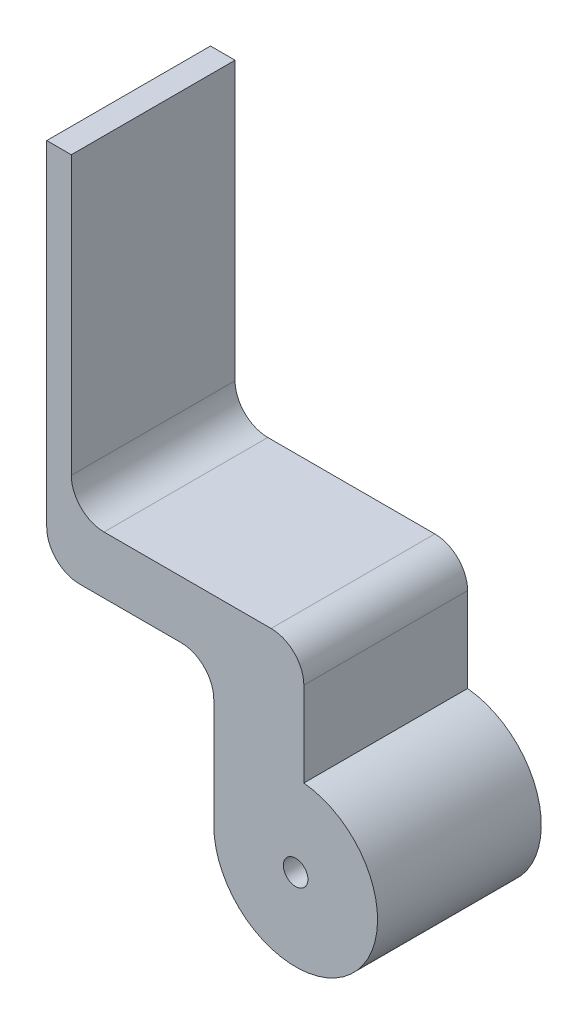
from build123d import *

# Parameters (mm, degrees)
BOSS_EXTRUDE2_DEPTH = 20
SKETCH2_R           = 1.5
CUT_EXTRUDE1_DEPTH  = 30


with BuildPart() as part:
    # Sketch1 → Boss-Extrude2 (new body)
    with BuildSketch(Plane.XY):
        with BuildLine():
            Line((-14, 17.3), (-26.4, 17.3))
            ThreePointArc((-26.4, 17.3), (-29.228427125, 18.471572875), (-30.4, 21.3))
            Line((-30.4, 21.3), (-30.4, 62.205522081))
            Line((-30.4, 62.205522081), (-27.4, 62.205522081))
            Line((-27.4, 62.205522081), (-27.4, 28.3))
            ThreePointArc((-27.4, 28.3), (-26.228427125, 25.471572875), (-23.4, 24.3))
            Line((-23.4, 24.3), (-3, 24.3))
            ThreePointArc((-3, 24.3), (-0.171572875, 23.128427125), (1, 20.3))
            Line((1, 20.3), (1, 9.949874371))
            ThreePointArc((1, 9.949874371), (6.708203932, -7.416198487), (-10, 0))
            Line((-10, 0), (-10, 13.3))
            ThreePointArc((-10, 13.3), (-11.171572875, 16.128427125), (-14, 17.3))
        make_face()
    extrude(amount=BOSS_EXTRUDE2_DEPTH)

    # Sketch2 → Cut-Extrude1 (cut)
    with BuildSketch(Plane.XY.offset(20)):
        Circle(SKETCH2_R)
    extrude(amount=-CUT_EXTRUDE1_DEPTH, mode=Mode.SUBTRACT)


solid = part.part
